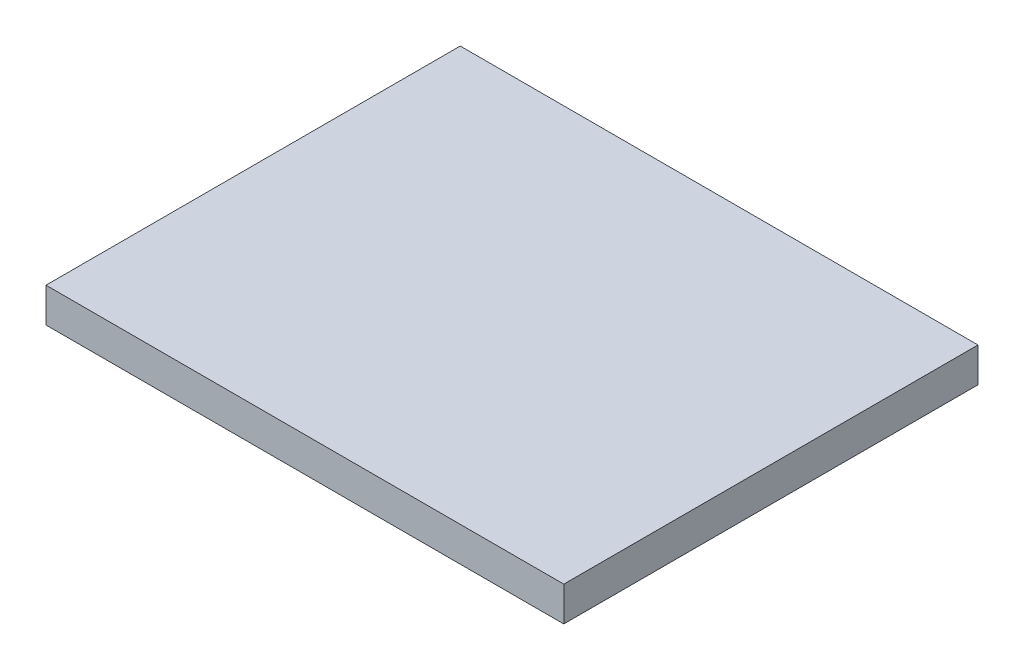
from build123d import *

# Parameters (mm, degrees)
SKETCH1_W           = 95.25
SKETCH1_H           = 76.2
BOSS_EXTRUDE1_DEPTH = 3.175


with BuildPart() as part:
    # Sketch1 → Boss-Extrude1 (new, symmetric)
    with BuildSketch(Plane(origin=(0, 0, 0), x_dir=(1, 0, 0), z_dir=(0, 1, 0))):
        Rectangle(SKETCH1_W, SKETCH1_H)
    extrude(amount=BOSS_EXTRUDE1_DEPTH, both=True)


solid = part.part
